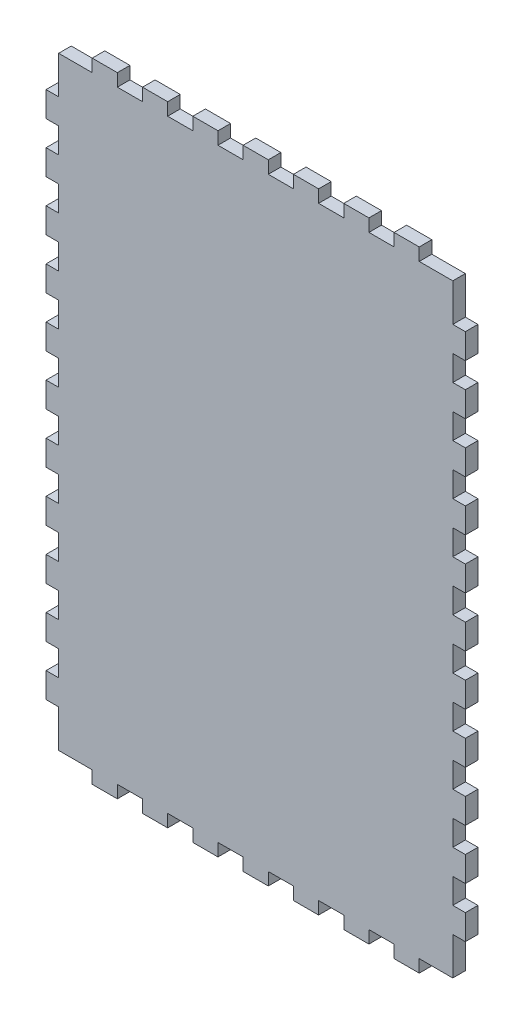
from build123d import *

# Parameters (mm, degrees)
BOSS_EXTRUDE1_DEPTH = 6


with BuildPart() as part:
    # Model → Boss-Extrude1 (new body)
    with BuildSketch(Plane.XY):
        Polygon((512, 600), (512, 582), (506, 582), (506, 570), (512, 570), (512, 558), (506, 558), (506, 546), (512, 546), (512, 534), (506, 534), (506, 522), (512, 522), (512, 510), (506, 510), (506, 498), (512, 498), (512, 486), (506, 486), (506, 474), (512, 474), (512, 462), (506, 462), (506, 450), (512, 450), (512, 438), (506, 438), (506, 426), (512, 426), (512, 414), (506, 414), (506, 402), (512, 402), (512, 390), (506, 390), (506, 378), (512, 378), (512, 366), (506, 366), (506, 354), (512, 354), (512, 342), (506, 342), (506, 330), (512, 330), (512, 318), (512, 312), (528, 312), (528, 306), (540, 306), (540, 312), (552, 312), (552, 306), (564, 306), (564, 312), (576, 312), (576, 306), (588, 306), (588, 312), (600, 312), (600, 306), (612, 306), (612, 312), (624, 312), (624, 306), (636, 306), (636, 312), (648, 312), (648, 306), (660, 306), (660, 312), (672, 312), (672, 306), (684, 306), (684, 312), (696, 312), (700, 312), (700, 330), (706, 330), (706, 342), (700, 342), (700, 354), (706, 354), (706, 366), (700, 366), (700, 378), (706, 378), (706, 390), (700, 390), (700, 402), (706, 402), (706, 414), (700, 414), (700, 426), (706, 426), (706, 438), (700, 438), (700, 450), (706, 450), (706, 462), (700, 462), (700, 474), (706, 474), (706, 486), (700, 486), (700, 498), (706, 498), (706, 510), (700, 510), (700, 522), (706, 522), (706, 534), (700, 534), (700, 546), (706, 546), (706, 558), (700, 558), (700, 570), (706, 570), (706, 582), (700, 582), (700, 594), (700, 600), (684, 600), (684, 606), (672, 606), (672, 600), (660, 600), (660, 606), (648, 606), (648, 600), (636, 600), (636, 606), (624, 606), (624, 600), (612, 600), (612, 606), (600, 606), (600, 600), (588, 600), (588, 606), (576, 606), (576, 600), (564, 600), (564, 606), (552, 606), (552, 600), (540, 600), (540, 606), (528, 606), (528, 600), (516, 600), align=None)
    extrude(amount=BOSS_EXTRUDE1_DEPTH)


solid = part.part
